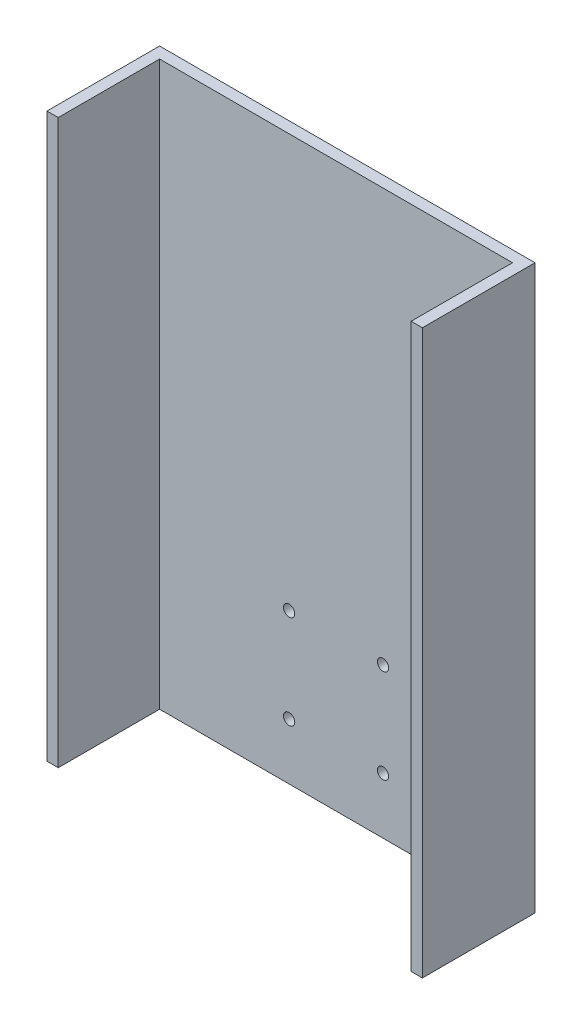
from build123d import *

# Parameters (mm, degrees)
SKETCH1_W           = 100
SKETCH1_H           = 150
BOSS_EXTRUDE1_DEPTH = 30
SHELL1_T            = -3
CUT_EXTRUDE2_REACH  = 96.096
SKETCH2_R           = 1.5


with BuildPart() as part:
    # Sketch1 → Boss-Extrude1 (new body)
    with BuildSketch(Plane.XY):
        Rectangle(SKETCH1_W, SKETCH1_H)
    extrude(amount=BOSS_EXTRUDE1_DEPTH)

    # Shell1
    shell1_openings = [part.faces().sort_by_distance(p)[0] for p in [
        (0, 0, 30),
        (0, 75, 15),
        (0, -75, 15),
    ]]
    offset(amount=SHELL1_T, openings=shell1_openings, kind=Kind.INTERSECTION)

    # Sketch2 → Cut-Extrude2 (cut, up to next)
    with BuildSketch(Plane.XY.offset(3), mode=Mode.PRIVATE) as cut_extrude2_sk1:
        with Locations((-12.5, -35)):
            Circle(SKETCH2_R)
    cut_extrude2_tool1 = extrude(cut_extrude2_sk1.sketch, amount=-CUT_EXTRUDE2_REACH, mode=Mode.PRIVATE) & part.part
    # Sketch2 → Cut-Extrude2 (cut, up to next)
    with BuildSketch(Plane.XY.offset(3), mode=Mode.PRIVATE) as cut_extrude2_sk2:
        with Locations((-12.5, -60)):
            Circle(SKETCH2_R)
    cut_extrude2_tool2 = extrude(cut_extrude2_sk2.sketch, amount=-CUT_EXTRUDE2_REACH, mode=Mode.PRIVATE) & part.part
    # Sketch2 → Cut-Extrude2 (cut, up to next)
    with BuildSketch(Plane.XY.offset(3), mode=Mode.PRIVATE) as cut_extrude2_sk3:
        with Locations((12.5, -60)):
            Circle(SKETCH2_R)
    cut_extrude2_tool3 = extrude(cut_extrude2_sk3.sketch, amount=-CUT_EXTRUDE2_REACH, mode=Mode.PRIVATE) & part.part
    # Sketch2 → Cut-Extrude2 (cut, up to next)
    with BuildSketch(Plane.XY.offset(3), mode=Mode.PRIVATE) as cut_extrude2_sk4:
        with Locations((12.5, -35)):
            Circle(SKETCH2_R)
    cut_extrude2_tool4 = extrude(cut_extrude2_sk4.sketch, amount=-CUT_EXTRUDE2_REACH, mode=Mode.PRIVATE) & part.part
    add(cut_extrude2_tool1.solids().sort_by_distance((-12.5, -35, 3))[0], mode=Mode.SUBTRACT)
    add(cut_extrude2_tool2.solids().sort_by_distance((-12.5, -60, 3))[0], mode=Mode.SUBTRACT)
    add(cut_extrude2_tool3.solids().sort_by_distance((12.5, -60, 3))[0], mode=Mode.SUBTRACT)
    add(cut_extrude2_tool4.solids().sort_by_distance((12.5, -35, 3))[0], mode=Mode.SUBTRACT)


solid = part.part
